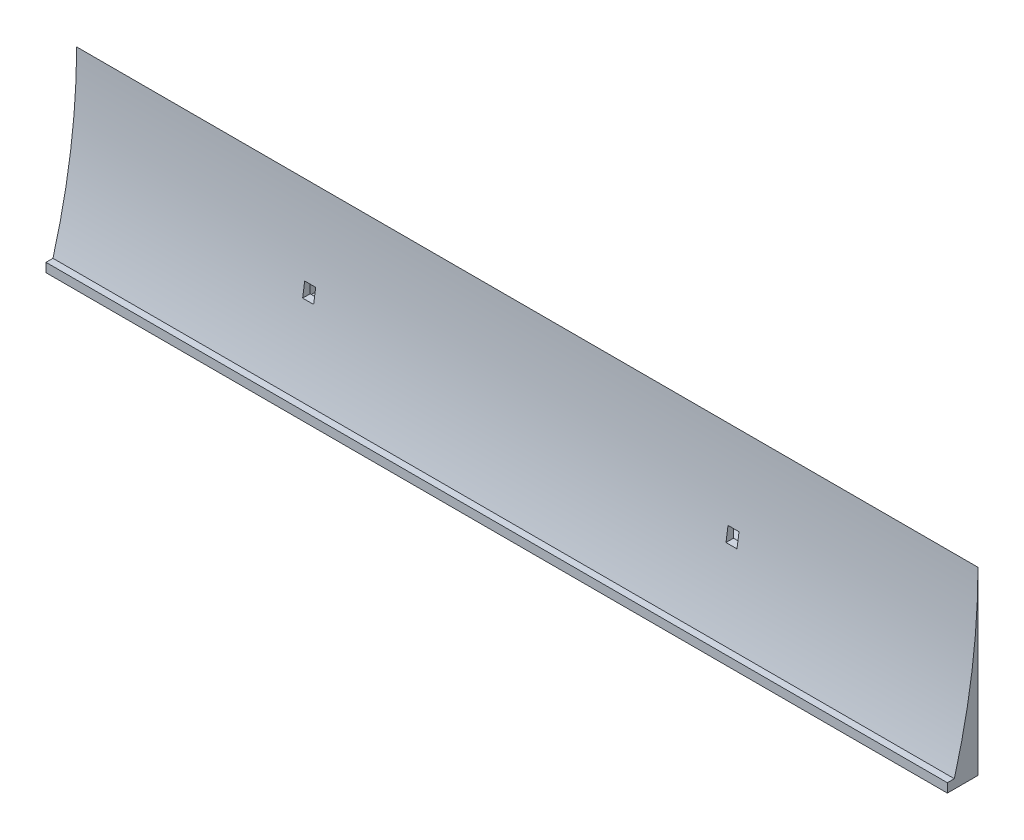
from build123d import *

# Parameters (mm, degrees)
ESQUISSE1_W             = 500
ESQUISSE1_H             = 100
BOSS_EXTRU_1_DEPTH      = 20
ENL_V_MAT_EXTRU_1_REACH = 504.892
ESQUISSE3_W             = 6.1
ESQUISSE3_H             = 7.7
ENL_V_MAT_EXTRU_2_DEPTH = 10
ESQUISSE4_W             = 30
ESQUISSE4_H             = 36.346168877
ESQUISSE4_W_2           = 24
ESQUISSE4_H_2           = 30.346168877
BOSS_EXTRU_2_DEPTH      = 25
ESQUISSE6_W             = 30
ESQUISSE6_H             = 36.346168877
BOSS_EXTRU_3_DEPTH      = 2
ESQUISSE7_W             = 30
ESQUISSE7_H             = 36.346168877
BOSS_EXTRU_4_DEPTH      = 2


with BuildPart() as part:
    # Esquisse1 → Boss.-Extru.1 (new body)
    with BuildSketch(Plane.XY):
        Rectangle(ESQUISSE1_W, ESQUISSE1_H)
    extrude(amount=BOSS_EXTRU_1_DEPTH)

    # Esquisse2 → Enlèv. mat.-Extru.1 (cut, up to next)
    with BuildSketch(Plane.ZY.offset(250), mode=Mode.PRIVATE) as enl_v_mat_extru_1_sk1:
        with BuildLine():
            Line((17, -45), (17, -50))
            Line((17, -50), (20, -50))
            Line((20, -50), (20, 50))
            Line((20, 50), (0, 50))
            ThreePointArc((0, 50), (3.30043493, 2.047819856), (13.139494746, -45))
            Line((13.139494746, -45), (17, -45))
        make_face()
    enl_v_mat_extru_1_tool1 = extrude(enl_v_mat_extru_1_sk1.sketch, amount=-ENL_V_MAT_EXTRU_1_REACH, mode=Mode.PRIVATE) & part.part
    add(enl_v_mat_extru_1_tool1.solids().sort_by_distance((-250, 8.554077, 11.753781))[0], mode=Mode.SUBTRACT)

    # Esquisse3 → Enlèv. mat.-Extru.2 (cut)
    with BuildSketch(Plane(origin=(0, 0, 0), x_dir=(-1, 0, 0), z_dir=(0, 0, -1))):
        with Locations((-117.418016387, 0)):
            Rectangle(ESQUISSE3_W, ESQUISSE3_H)
        with Locations((117.418016387, 0)):
            Rectangle(ESQUISSE3_W, ESQUISSE3_H)
    extrude(amount=-ENL_V_MAT_EXTRU_2_DEPTH, mode=Mode.SUBTRACT)

    # Esquisse4 → Boss.-Extru.2 (add)
    # profile 1 of 2: a face of its own
    with BuildSketch(Plane.XY):
        with Locations((-115, 4.12276014)):
            Rectangle(ESQUISSE4_W, ESQUISSE4_H)
        with Locations((-115, 4.12276014)):
            Rectangle(ESQUISSE4_W_2, ESQUISSE4_H_2, mode=Mode.SUBTRACT)
    # profile 2 of 2: a face of its own
    with BuildSketch(Plane.XY):
        with Locations((115, 4.12276014)):
            Rectangle(ESQUISSE4_W, ESQUISSE4_H)
        with Locations((115, 4.12276014)):
            Rectangle(ESQUISSE4_W_2, ESQUISSE4_H_2, mode=Mode.SUBTRACT)
    extrude(amount=-BOSS_EXTRU_2_DEPTH)

    # Esquisse6 → Boss.-Extru.3 (add)
    with BuildSketch(Plane(origin=(0, 0, -25), x_dir=(-1, 0, 0), z_dir=(0, 0, -1))):
        with Locations((-115, 4.12276014)):
            Rectangle(ESQUISSE6_W, ESQUISSE6_H)
    extrude(amount=BOSS_EXTRU_3_DEPTH)

    # Esquisse7 → Boss.-Extru.4 (add)
    with BuildSketch(Plane(origin=(0, 0, -25), x_dir=(-1, 0, 0), z_dir=(0, 0, -1))):
        with Locations((115, 4.12276014)):
            Rectangle(ESQUISSE7_W, ESQUISSE7_H)
    extrude(amount=BOSS_EXTRU_4_DEPTH)


solid = part.part
